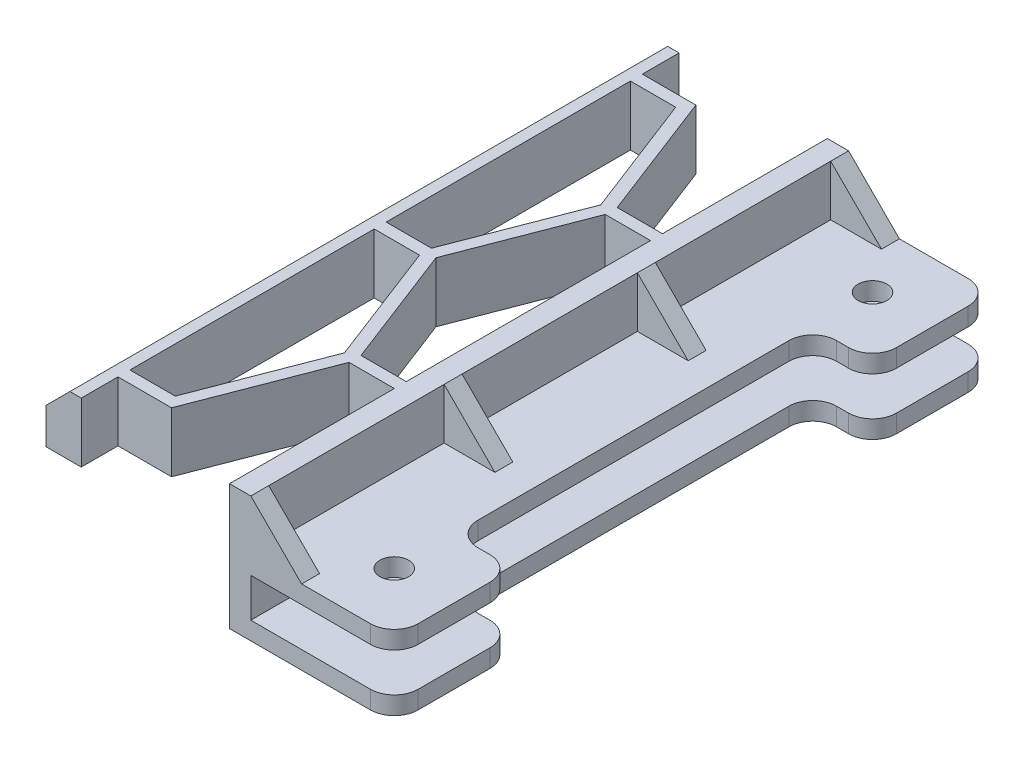
from build123d import *

# Parameters (mm, degrees)
BOSS_EXTRUDE1_DEPTH                             = 5
BOSS_EXTRUDE3_DEPTH                             = 1.5
BOSS_EXTRUDE4_REACH                             = 55.614
SKETCH5_3_W                                     = 1.78
SKETCH5_3_H                                     = 50
BOSS_EXTRUDE5_DEPTH                             = 1.5
FILLET1_R                                       = 2
CSK_FOR_M2_FLAT_HEAD_MACHINE_SCREW2_D           = 2.4
CSK_FOR_M2_FLAT_HEAD_MACHINE_SCREW2_CSINK_D     = 4.4
CSK_FOR_M2_FLAT_HEAD_MACHINE_SCREW2_CSINK_ANGLE = 90
CHAMFER1_SIZE                                   = 2
BOSS_EXTRUDE6_DEPTH                             = 1.5
LPATTERN1_COUNT                                 = 4
LPATTERN1_PITCH                                 = 16.166666667


with BuildPart() as part:
    # Sketch1 → Boss-Extrude1 (new body)
    with BuildSketch(Plane(origin=(0, 4, 0), x_dir=(1, 0, 0), z_dir=(0, 1, 0))):
        Polygon((-14.18, 46.928571429), (-14.18, 50), (-17.13, 50), (-17.13, 0), (-14.18, 0), (-14.18, 3.071428571), (-9.703639402, 3.071428571), (-5.570306069, 13.785714286), (-1.78, 13.785714286), (-1.78, 0), (0, 0), (0, 50), (-1.78, 50), (-1.78, 36.214285714), (-5.570306069, 36.214285714), (-9.703639402, 46.928571429), align=None)
        Polygon((-14.18, 4.071428571), (-14.18, 24.5), (-10.389693931, 24.5), (-6.449249487, 14.285714286), (-10.389693931, 4.071428571), align=None, mode=Mode.SUBTRACT)
        Polygon((-10.389693931, 45.928571429), (-6.449249487, 35.714285714), (-10.389693931, 25.5), (-14.18, 25.5), (-14.18, 45.928571429), align=None, mode=Mode.SUBTRACT)
        Polygon((-5.570306069, 14.785714286), (-9.510750513, 25), (-5.570306069, 35.214285714), (-1.78, 35.214285714), (-1.78, 14.785714286), align=None, mode=Mode.SUBTRACT)
    extrude(amount=BOSS_EXTRUDE1_DEPTH)

    # Sketch5<3> → Boss-Extrude4 (add, up to next)
    with BuildSketch(Plane.XZ, mode=Mode.PRIVATE) as boss_extrude4_sk1:
        with Locations((-0.89, -25)):
            Rectangle(SKETCH5_3_W, SKETCH5_3_H)
    boss_extrude4_tool1 = extrude(boss_extrude4_sk1.sketch, amount=-BOSS_EXTRUDE4_REACH, mode=Mode.PRIVATE) - part.part


with BuildPart() as body_2:
    # Sketch5 → Boss-Extrude3 (new body)
    with BuildSketch(Plane.XZ):
        Polygon((12, -50), (12, -40), (7, -40), (7, -10), (12, -10), (12, 0), (-1.78, 0), (-1.78, -50), align=None)
    extrude(amount=BOSS_EXTRUDE3_DEPTH)


with BuildPart() as part_1:
    add(part.part)

    add(body_2.part)  # Boss-Extrude4 merges body 2
    add(boss_extrude4_tool1.solids().sort_by_distance((-0.89, 0, -25))[0])

    # Sketch7 → Boss-Extrude5 (add)
    with BuildSketch(Plane(origin=(0, 3.25, 0), x_dir=(1, 0, 0), z_dir=(0, 1, 0))):
        Polygon((12, 40), (12, 50), (0, 50), (0, 0), (12, 0), (12, 10), (7, 10), (7, 40), align=None)
    extrude(amount=BOSS_EXTRUDE5_DEPTH)

    # Fillet1
    fillet1_edges = [part_1.edges().sort_by_distance(p)[0] for p in [
        (12, -0.75, -10),
        (7, -0.75, -10),
        (7, -0.75, -40),
        (12, -0.75, -40),
        (12, -0.75, -50),
        (12, -0.75, 0),
        (12, 4, -50),
        (12, 4, -40),
        (7, 4, -40),
        (7, 4, -10),
        (12, 4, -10),
        (12, 4, 0),
    ]]
    fillet(fillet1_edges, radius=FILLET1_R)

    # CSK for M2 Flat Head Machine Screw2 (through all)
    with Locations(Plane(origin=(0, -1.5, 0), x_dir=(-1, 0, 0), z_dir=(0, -1, 0))):
        with Locations((-7, 45), (-7, 5)):
            CounterSinkHole(CSK_FOR_M2_FLAT_HEAD_MACHINE_SCREW2_D / 2, CSK_FOR_M2_FLAT_HEAD_MACHINE_SCREW2_CSINK_D / 2, counter_sink_angle=CSK_FOR_M2_FLAT_HEAD_MACHINE_SCREW2_CSINK_ANGLE)

    # Chamfer1
    chamfer1_edges = [part_1.edges().sort_by_distance(p)[0] for p in [
        (-17.13, 9, -25),
    ]]
    chamfer(chamfer1_edges, length=CHAMFER1_SIZE)

    # Sketch11 → Boss-Extrude6 (add)
    with BuildSketch(Plane.XY):
        Polygon((0, 9), (0, 4.75), (4.25, 4.75), align=None)
    boss_extrude6 = extrude(amount=-BOSS_EXTRUDE6_DEPTH)

    # LPattern1: Boss-Extrude6 ×4
    with Locations(*[(0, 0, -i * LPATTERN1_PITCH) for i in range(1, LPATTERN1_COUNT)]):
        add(boss_extrude6)


solid = part_1.part
